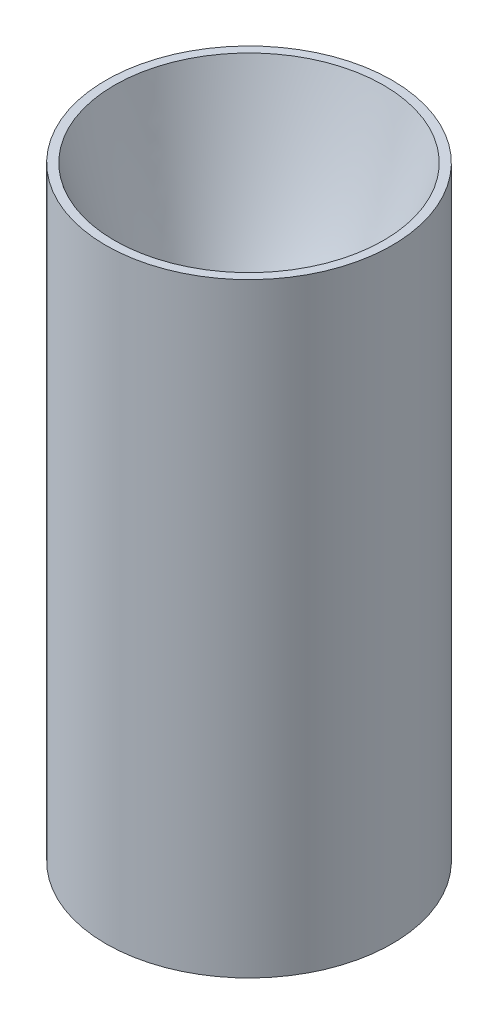
from build123d import *

# Parameters (mm, degrees)
CIRPATTERN1_COUNT = 8


with BuildPart() as part:
    # Sketch1 → Revolve2 (revolve)
    with BuildSketch(Plane.XY):
        with BuildLine():
            Line((71.638455479, 109.927347077), (76.2, 109.927347077))
            Line((76.2, 109.927347077), (76.2, -212.12767375))
            Line((76.2, -212.12767375), (53.792460136, -212.12767375))
            Line((53.792460136, -212.12767375), (53.792460136, -59.72767375))
            add(Edge.make_bspline(
                [(53.792460136, -59.72767375), (53.792458904, -59.65714368), (53.79192976, -59.515566627), (53.789553906, -59.18172514), (53.783229304, -58.904956016), (53.773743812, -58.532728011), (53.761100911, -58.212998146), (53.741350078, -57.781754967), (53.711337732, -57.281120424), (53.667125562, -56.68815869), (53.588220883, -55.848640892), (53.488359283, -55.008326387), (53.367608198, -54.172595959), (53.197743223, -53.17258577), (53.002996576, -52.177603354), (52.777307499, -51.188699619), (52.520946592, -50.207649576), (52.240221697, -49.233238281), (51.935281085, -48.266129768), (51.544470164, -47.149295616), (51.050452679, -45.89056896), (50.509666057, -44.651129364), (49.922993218, -43.432862093), (49.291052508, -42.237253813), (48.615057493, -41.066315461), (47.895407771, -39.921133247), (47.134034376, -38.804236838), (46.430801288, -37.851612392), (45.804470156, -37.055832736), (45.263749892, -36.403541902), (44.826059154, -35.894408258), (44.42570839, -35.447153287), (44.092389699, -35.084791818), (43.784856817, -34.760500788), (43.585004597, -34.55171009), (43.35532426, -34.318676929), (43.254715338, -34.217322698), (43.20484319, -34.167450311)],
                knots=[0.082637729, 0.082637729, 0.082637729, 0.082637729, 0.082637729, 0.092574926, 0.102512123, 0.11244932, 0.122386517, 0.132323714, 0.142260911, 0.162135305, 0.182009699, 0.201884093, 0.24163288, 0.261507274, 0.281381668, 0.321130456, 0.360879243, 0.380753637, 0.400628031, 0.440376819, 0.480125606, 0.519874394, 0.559623181, 0.599371969, 0.639120757, 0.678869544, 0.718618332, 0.75836712, 0.798115907, 0.817990301, 0.837864695, 0.857739089, 0.877613483, 0.88755068, 0.897487877, 0.907425074, 0.91736227, 0.91736227, 0.91736227, 0.91736227, 0.91736227], degree=4))
            Line((43.20484319, -34.167450311), (34.597214993, -25.559822115))
            add(Edge.make_bspline(
                [(24.01, 0), (24.010001231, -0.070528647), (24.010530378, -0.21358419), (24.012906064, -0.543182916), (24.019230459, -0.824160397), (24.028715581, -1.194822072), (24.041357874, -1.513435058), (24.057158099, -1.861939603), (24.076113358, -2.193706872), (24.103750973, -2.6180694), (24.143219181, -3.122033947), (24.214231843, -3.879978675), (24.334058816, -4.886450388), (24.510418185, -6.05671076), (24.761817377, -7.385166415), (25.062727461, -8.703574514), (25.412702774, -10.009637208), (25.811293137, -11.301819596), (26.257877549, -12.578099334), (26.751935483, -13.836887483), (27.292605285, -15.076197128), (27.879411553, -16.294609793), (28.511071567, -17.489938793), (29.187464568, -18.661287756), (29.906377277, -19.805743395), (30.668954178, -20.923860073), (31.370099373, -21.874411759), (31.999668305, -22.673445479), (32.535060601, -23.320422136), (32.983187953, -23.840005015), (33.419382213, -24.329816244), (33.846758309, -24.788484388), (34.156490828, -25.113868308), (34.447792147, -25.409649045), (34.547344615, -25.50994993), (34.597214993, -25.559822115)],
                knots=[0.082637729, 0.082637729, 0.082637729, 0.082637729, 0.082637729, 0.092574926, 0.102512123, 0.11244932, 0.122386517, 0.132323714, 0.142260911, 0.152198108, 0.162135305, 0.182009699, 0.201884093, 0.24163288, 0.281381668, 0.321130456, 0.360879243, 0.400628031, 0.440376819, 0.480125606, 0.519874394, 0.559623181, 0.599371969, 0.639120757, 0.678869544, 0.718618332, 0.75836712, 0.798115907, 0.817990301, 0.837864695, 0.857739089, 0.877613483, 0.897487877, 0.907425074, 0.91736227, 0.91736227, 0.91736227, 0.91736227, 0.91736227], degree=4))
            add(Edge.make_bspline(
                [(24.01, 0), (24.010000626, 0.035892652), (24.010538457, 0.11011369), (24.012955849, 0.267641069), (24.019393694, 0.427064117), (24.031465725, 0.646764266), (24.052367213, 0.901433328), (24.086116845, 1.202537273), (24.137431431, 1.542050498), (24.201475827, 1.880996777), (24.278073727, 2.21635442), (24.367255697, 2.549239421), (24.468673539, 2.878092645), (24.582551197, 3.203347041), (24.708128897, 3.523627157), (24.846218103, 3.839666733), (24.995002427, 4.149282184), (25.156944348, 4.454783123), (25.327420631, 4.751301575), (25.513446847, 5.045703861), (25.702720396, 5.325518936), (25.9153376, 5.610727543), (26.0898085, 5.832913647), (26.277277882, 6.049951637), (26.415487374, 6.208641646), (26.581374196, 6.382121779), (26.655452387, 6.458478841), (26.706211329, 6.50923965)],
                knots=[0.082568816, 0.082568816, 0.082568816, 0.082568816, 0.082568816, 0.102426634, 0.122284453, 0.142142271, 0.162000089, 0.201715725, 0.241431362, 0.281146998, 0.320862634, 0.360578271, 0.400293907, 0.440009544, 0.47972518, 0.519440816, 0.559156453, 0.598872089, 0.638587725, 0.678303362, 0.718018998, 0.757734635, 0.797450271, 0.837165907, 0.857023726, 0.876881544, 0.91659718, 0.91659718, 0.91659718, 0.91659718, 0.91659718], degree=4))
            add(Edge.make_bspline(
                [(26.706211329, 6.50923965), (49.172333461, 34.635954224), (71.638455479, 109.927347077)],
                knots=[0, 0, 0, 1, 1, 1], degree=2))
        make_face()
    revolve(axis=Axis((0, 0, 0), (0, -1, 0)))

    # Sketch4 → 3/8-24 Tapped Hole1 (revolve, cut)
    with BuildSketch(Plane(origin=(66.675, -212.12767375, 0), x_dir=(0, 0, -1), z_dir=(1, 0, 0))):
        Polygon((0, 0), (0, 27.534688714), (4.2164, 25.00122), (4.2164, 0), align=None)
    f_3_8_24_tapped_hole1 = revolve(axis=Axis((66.675, -218.47767375, 0), (0, 1, 0)), mode=Mode.SUBTRACT)

    # CirPattern1: 3/8-24 Tapped Hole1 ×8 about axis
    cirpattern1_axis = Axis((0, -212.12767375, 0), (0, 1, 0))
    for i in range(1, CIRPATTERN1_COUNT):
        add(f_3_8_24_tapped_hole1.rotate(cirpattern1_axis, i * 360 / CIRPATTERN1_COUNT), mode=Mode.SUBTRACT)


solid = part.part
